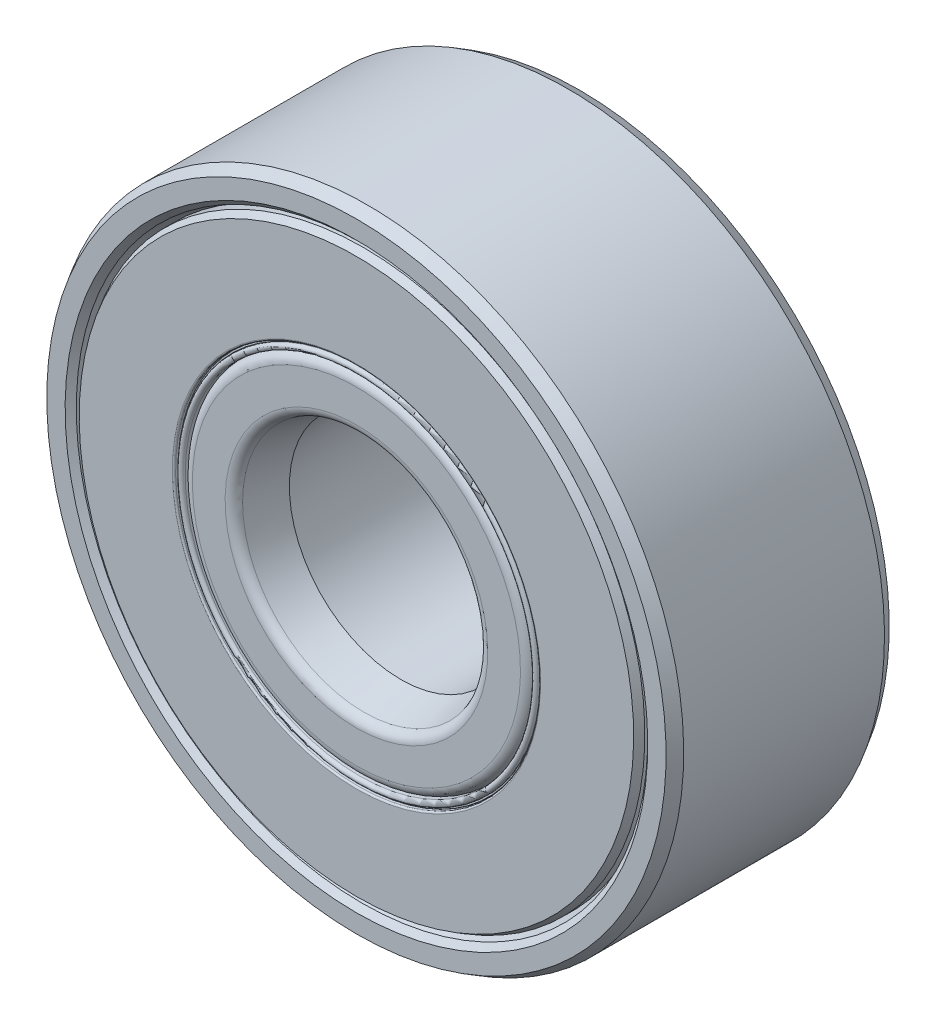
from build123d import *

# Parameters (mm, degrees)
CIRPATTERN1_COUNT = 7


with BuildPart() as part:
    # Sketch3 → Revolve1 (revolve)
    with BuildSketch(Plane(origin=(0, 0, 0), x_dir=(0, 0, -1), z_dir=(1, 0, 0)), mode=Mode.PRIVATE) as revolve1_sk:
        with BuildLine():
            Line((-2.524480927, 7.565), (-2.85, 7.683479253))
            Line((-2.85, 7.683479253), (-3, 7.833479253))
            Line((-3, 7.833479253), (-3, 8.326794919))
            Line((-3, 8.326794919), (-2.7, 8.5))
            Line((-2.7, 8.5), (2.7, 8.5))
            Line((2.7, 8.5), (3, 8.326794919))
            Line((3, 8.326794919), (3, 7.833479253))
            Line((3, 7.833479253), (2.85, 7.683479253))
            Line((2.85, 7.683479253), (2.524480927, 7.565))
            Line((2.524480927, 7.565), (1.477398239, 7.565))
            ThreePointArc((1.477398239, 7.565), (0, 8.188333333), (-1.477398239, 7.565))
            Line((-1.477398239, 7.565), (-2.524480927, 7.565))
        make_face()
    revolve(revolve1_sk.sketch.rotate(Axis((0, 0, 3), (0, 0, -1)), 180), axis=Axis((0, 0, 3), (0, 0, -1)))


with BuildPart() as body_2:
    # Sketch4 → Revolve2 (revolve)
    with BuildSketch(Plane(origin=(0, 0, 0), x_dir=(0, 0, -1), z_dir=(1, 0, 0)), mode=Mode.PRIVATE) as revolve2_sk:
        with BuildLine():
            Line((-1.803915403, 3), (-2.796018909, 3.265833333))
            ThreePointArc((-2.796018909, 3.265833333), (-2.943128583, 3.364128875), (-3, 3.531666667))
            Line((-3, 3.531666667), (-3, 4.411455749))
            ThreePointArc((-3, 4.411455749), (-2.919392588, 4.606059255), (-2.724789082, 4.686666667))
            Line((-2.724789082, 4.686666667), (-1.477398239, 4.686666667))
            ThreePointArc((-1.477398239, 4.686666667), (0, 4.063333333), (1.477398239, 4.686666667))
            Line((1.477398239, 4.686666667), (2.724789082, 4.686666667))
            ThreePointArc((2.724789082, 4.686666667), (2.919392588, 4.606059255), (3, 4.411455749))
            Line((3, 4.411455749), (3, 3.531666667))
            ThreePointArc((3, 3.531666667), (2.943128583, 3.364128875), (2.796018909, 3.265833333))
            Line((2.796018909, 3.265833333), (1.803915403, 3))
            Line((1.803915403, 3), (-1.803915403, 3))
        make_face()
    revolve(revolve2_sk.sketch.rotate(Axis((0, 0, 3), (0, 0, -1)), 180), axis=Axis((0, 0, 3), (0, 0, -1)))


with BuildPart() as body_3:
    # Sketch5 → Revolve3 (revolve)
    with BuildSketch(Plane(origin=(0, 0, 0), x_dir=(0, 0, -1), z_dir=(1, 0, 0))):
        with BuildLine():
            Line((-2.0625, 6.125833333), (2.0625, 6.125833333))
            ThreePointArc((2.0625, 6.125833333), (0, 8.188333333), (-2.0625, 6.125833333))
        make_face()
    revolve(axis=Axis((0, 6.125833333, 2.0625), (0, 0, -1)))


with BuildPart() as cirpattern1_1:
    # CirPattern1: pattern copy
    add(body_3.part.rotate(Axis((0, 0, 0), (0, 0, 1)), 1 * 360 / CIRPATTERN1_COUNT))


with BuildPart() as cirpattern1_2:
    # CirPattern1: pattern copy
    add(body_3.part.rotate(Axis((0, 0, 0), (0, 0, 1)), 2 * 360 / CIRPATTERN1_COUNT))


with BuildPart() as cirpattern1_3:
    # CirPattern1: pattern copy
    add(body_3.part.rotate(Axis((0, 0, 0), (0, 0, 1)), 3 * 360 / CIRPATTERN1_COUNT))


with BuildPart() as cirpattern1_4:
    # CirPattern1: pattern copy
    add(body_3.part.rotate(Axis((0, 0, 0), (0, 0, 1)), 4 * 360 / CIRPATTERN1_COUNT))


with BuildPart() as cirpattern1_5:
    # CirPattern1: pattern copy
    add(body_3.part.rotate(Axis((0, 0, 0), (0, 0, 1)), 5 * 360 / CIRPATTERN1_COUNT))


with BuildPart() as cirpattern1_6:
    # CirPattern1: pattern copy
    add(body_3.part.rotate(Axis((0, 0, 0), (0, 0, 1)), 6 * 360 / CIRPATTERN1_COUNT))


with BuildPart() as body_10:
    # Sketch6 → Revolve4 (revolve)
    with BuildSketch(Plane(origin=(0, 0, 0), x_dir=(0, 0, -1), z_dir=(1, 0, 0)), mode=Mode.PRIVATE) as revolve4_sk:
        with BuildLine():
            Line((-2.809474411, 7.565), (-2.0625, 7.565))
            Line((-2.0625, 7.565), (-2.0625, 4.906666667))
            Line((-2.0625, 4.906666667), (-2.956, 4.906666667))
            ThreePointArc((-2.956, 4.906666667), (-2.987112698, 4.919553968), (-3, 4.950666667))
            Line((-3, 4.950666667), (-3, 7.455))
            Line((-3, 7.455), (-2.809474411, 7.565))
        make_face()
        with BuildLine():
            Line((2.956, 4.906666667), (2.0625, 4.906666667))
            Line((2.0625, 4.906666667), (2.0625, 7.565))
            Line((2.0625, 7.565), (2.809474411, 7.565))
            Line((2.809474411, 7.565), (3, 7.455))
            Line((3, 7.455), (3, 4.950666667))
            ThreePointArc((3, 4.950666667), (2.987112698, 4.919553968), (2.956, 4.906666667))
        make_face()
    revolve(revolve4_sk.sketch.rotate(Axis((0, 0, 3), (0, 0, -1)), 180), axis=Axis((0, 0, 3), (0, 0, -1)))


with BuildPart() as body_11:
    # Sketch7 → Revolve5 (revolve)
    with BuildSketch(Plane(origin=(0, 0, 0), x_dir=(0, 0, -1), z_dir=(1, 0, 0)), mode=Mode.PRIVATE) as revolve5_sk:
        with BuildLine():
            Line((-2.0625, 4.906666667), (-2.842311876, 4.906666667))
            Line((-2.842311876, 4.906666667), (-2.896476303, 4.897116017))
            ThreePointArc((-2.896476303, 4.897116017), (-2.91531148, 4.872569537), (-2.8925, 4.851666667))
            Line((-2.8925, 4.851666667), (-2.9175, 4.851666667))
            ThreePointArc((-2.9175, 4.851666667), (-3, 4.769166667), (-2.9175, 4.686666667))
            Line((-2.9175, 4.686666667), (-2.0625, 4.686666667))
            Line((-2.0625, 4.686666667), (-2.0625, 4.906666667))
        make_face()
    revolve(revolve5_sk.sketch.rotate(Axis((0, 0, 3), (0, 0, -1)), 180), axis=Axis((0, 0, 3), (0, 0, -1)))


solid = Compound([part.part, body_2.part, body_3.part, cirpattern1_1.part, cirpattern1_2.part, cirpattern1_3.part, cirpattern1_4.part, cirpattern1_5.part, cirpattern1_6.part, body_10.part, body_11.part])
